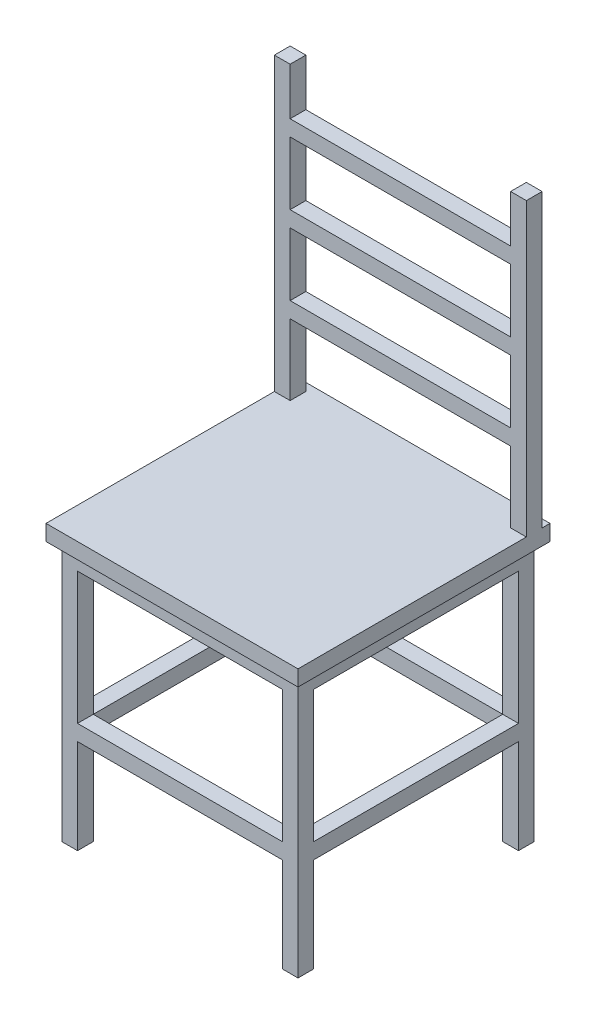
from build123d import *

# Parameters (mm, degrees)
SKETCH1_W            = 406.4
SKETCH1_H            = 406.4
BOSS_EXTRUDE1_DEPTH  = 25.4
SKETCH2_W            = 25.4
SKETCH2_H            = 25.4
SKETCH2_W_2          = 330.2
SKETCH2_H_2          = 330.2
BOSS_EXTRUDE4_DEPTH  = 28.575
SKETCH4_W            = 25.4
SKETCH4_H            = 25.4
BOSS_EXTRUDE5_DEPTH  = 390.525
SKETCH6_W            = 25.4
SKETCH6_H            = 25.4
BOSS_EXTRUDE6_DEPTH  = 355.6
SKETCH8_W            = 25.4
SKETCH8_H            = 25.4
BOSS_EXTRUDE7_DEPTH  = 355.6
SKETCH9_W            = 25.4
SKETCH9_H            = 25.4
BOSS_EXTRUDE8_DEPTH  = 355.6
SKETCH10_W           = 25.4
SKETCH10_H           = 25.4
BOSS_EXTRUDE9_DEPTH  = 355.6
SKETCH11_W           = 25.4
SKETCH11_H           = 25.4
BOSS_EXTRUDE11_DEPTH = 469.9
SKETCH12_W           = 25.4
SKETCH12_H           = 25.4
BOSS_EXTRUDE12_DEPTH = 376.174


with BuildPart() as part:
    # Sketch1 → Boss-Extrude1 (new body)
    with BuildSketch(Plane(origin=(0, 0, 0), x_dir=(1, 0, 0), z_dir=(0, 1, 0))):
        with Locations((203.2, 203.2)):
            Rectangle(SKETCH1_W, SKETCH1_H)
    extrude(amount=BOSS_EXTRUDE1_DEPTH)

    # Sketch2 → Boss-Extrude4 (add)
    with BuildSketch(Plane.XZ):
        with Locations((25.4, -25.4)):
            Rectangle(SKETCH2_W, SKETCH2_H)
        with Locations((203.2, -25.4)):
            Rectangle(SKETCH2_W_2, SKETCH2_H)
        with Locations((25.4, -203.2)):
            Rectangle(SKETCH2_W, SKETCH2_H_2)
        with Locations((203.2, -381)):
            Rectangle(SKETCH2_W_2, SKETCH2_H)
        with Locations((25.4, -381)):
            Rectangle(SKETCH2_W, SKETCH2_H)
        with Locations((381, -381)):
            Rectangle(SKETCH2_W, SKETCH2_H)
        with Locations((381, -203.2)):
            Rectangle(SKETCH2_W, SKETCH2_H_2)
        with Locations((381, -25.4)):
            Rectangle(SKETCH2_W, SKETCH2_H)
    extrude(amount=BOSS_EXTRUDE4_DEPTH)

    # Sketch4 → Boss-Extrude5 (add)
    with BuildSketch(Plane.XZ.offset(28.575)):
        with Locations((25.4, -25.4)):
            Rectangle(SKETCH4_W, SKETCH4_H)
        with Locations((381, -25.4)):
            Rectangle(SKETCH4_W, SKETCH4_H)
        with Locations((381, -381)):
            Rectangle(SKETCH4_W, SKETCH4_H)
        with Locations((25.4, -381)):
            Rectangle(SKETCH4_W, SKETCH4_H)
    extrude(amount=BOSS_EXTRUDE5_DEPTH)

    # Sketch6 → Boss-Extrude6 (add)
    with BuildSketch(Plane(origin=(38.1, 0, 0), x_dir=(0, 0, -1), z_dir=(1, 0, 0))):
        with Locations((25.4, -254)):
            Rectangle(SKETCH6_W, SKETCH6_H)
    extrude(amount=BOSS_EXTRUDE6_DEPTH)

    # Sketch8 → Boss-Extrude7 (add)
    with BuildSketch(Plane(origin=(0, 0, -38.1), x_dir=(-1, 0, 0), z_dir=(0, 0, -1))):
        with Locations((-381, -254)):
            Rectangle(SKETCH8_W, SKETCH8_H)
    extrude(amount=BOSS_EXTRUDE7_DEPTH)

    # Sketch9 → Boss-Extrude8 (add)
    with BuildSketch(Plane.ZY.offset(-368.3)):
        with Locations((-381, -254)):
            Rectangle(SKETCH9_W, SKETCH9_H)
    extrude(amount=BOSS_EXTRUDE8_DEPTH)

    # Sketch10 → Boss-Extrude9 (add)
    with BuildSketch(Plane.XY.offset(-368.3)):
        with Locations((25.4, -254)):
            Rectangle(SKETCH10_W, SKETCH10_H)
    extrude(amount=BOSS_EXTRUDE9_DEPTH)

    # Sketch11 → Boss-Extrude11 (add)
    with BuildSketch(Plane(origin=(0, 25.4, 0), x_dir=(1, 0, 0), z_dir=(0, 1, 0))):
        with Locations((12.7, 381)):
            Rectangle(SKETCH11_W, SKETCH11_H)
        with Locations((393.7, 381)):
            Rectangle(SKETCH11_W, SKETCH11_H)
    extrude(amount=BOSS_EXTRUDE11_DEPTH)

    # Sketch12 → Boss-Extrude12 (add)
    with BuildSketch(Plane.ZY.offset(-381)):
        with Locations((-381, 406.4)):
            Rectangle(SKETCH12_W, SKETCH12_H)
        with Locations((-381, 279.4)):
            Rectangle(SKETCH12_W, SKETCH12_H)
        with Locations((-381, 152.4)):
            Rectangle(SKETCH12_W, SKETCH12_H)
    extrude(amount=BOSS_EXTRUDE12_DEPTH)


solid = part.part
